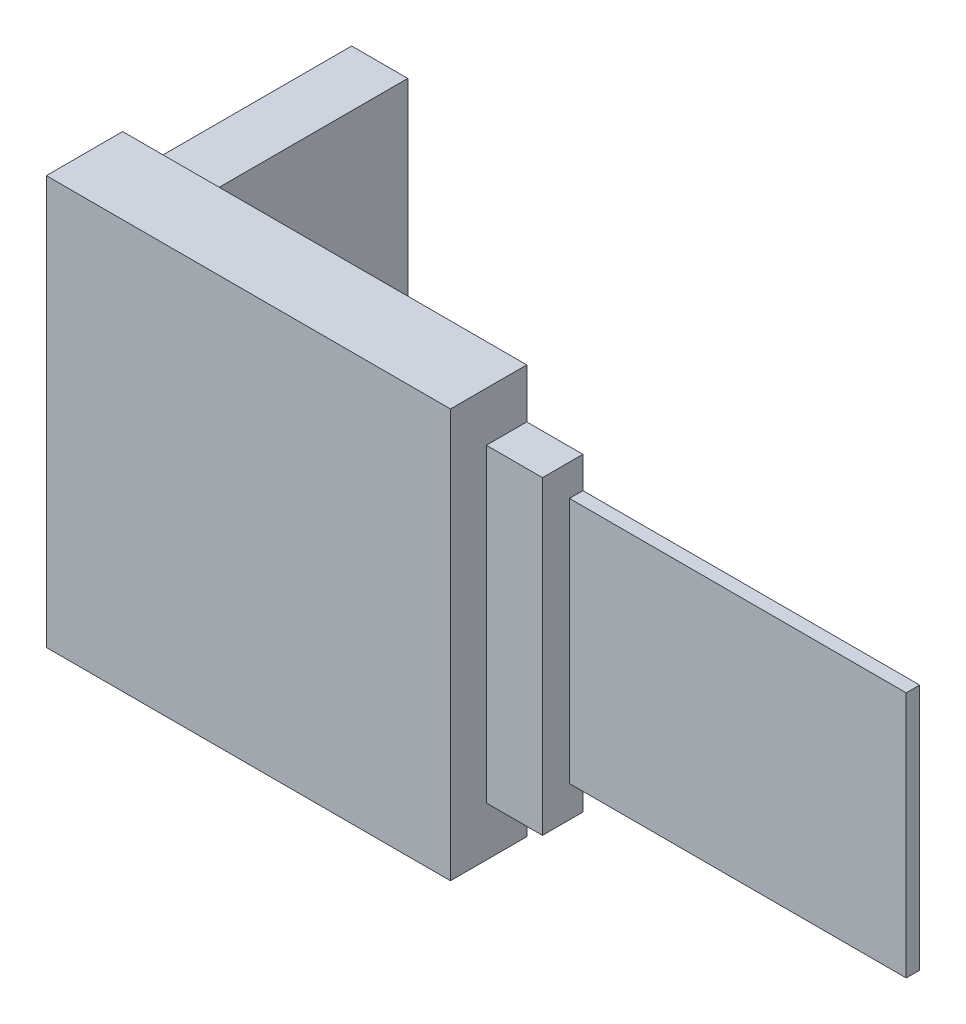
from build123d import *

# Parameters (mm, degrees)
SKETCH_1_W      = 18
SKETCH_1_H      = 18.2
EXTRUDE_1_DEPTH = 3.4
SKETCH_2_W      = 2.5
SKETCH_2_H      = 15
EXTRUDE_2_DEPTH = 10
SKETCH_3_W      = 2.5
SKETCH_3_H      = 13.8
EXTRUDE_3_DEPTH = 1.8
SKETCH_4_W      = 15
SKETCH_4_H      = 11
EXTRUDE_4_DEPTH = 0.6


with BuildPart() as part:
    # 草圖1 → 填料-伸長1 (new body)
    with BuildSketch(Plane.XY):
        with Locations((-39.034480155, -77.607444045)):
            Rectangle(SKETCH_1_W, SKETCH_1_H)
    extrude(amount=EXTRUDE_1_DEPTH)

    # 草圖2 → 填料-伸長2 (add)
    with BuildSketch(Plane(origin=(0, 0, 0), x_dir=(-1, 0, 0), z_dir=(0, 0, -1))):
        with Locations((46.584480155, -77.607444045)):
            Rectangle(SKETCH_2_W, SKETCH_2_H)
    extrude(amount=EXTRUDE_2_DEPTH)

    # 草圖3 → 填料-伸長3 (add)
    with BuildSketch(Plane(origin=(0, 0, 0), x_dir=(-1, 0, 0), z_dir=(0, 0, -1))):
        with Locations((28.784480155, -77.607444045)):
            Rectangle(SKETCH_3_W, SKETCH_3_H)
    extrude(amount=-EXTRUDE_3_DEPTH)

    # 草圖4 → 填料-伸長4 (add)
    with BuildSketch(Plane(origin=(0, 0, 0), x_dir=(-1, 0, 0), z_dir=(0, 0, -1))):
        with Locations((20.034480155, -77.607444045)):
            Rectangle(SKETCH_4_W, SKETCH_4_H)
    extrude(amount=-EXTRUDE_4_DEPTH)


solid = part.part
